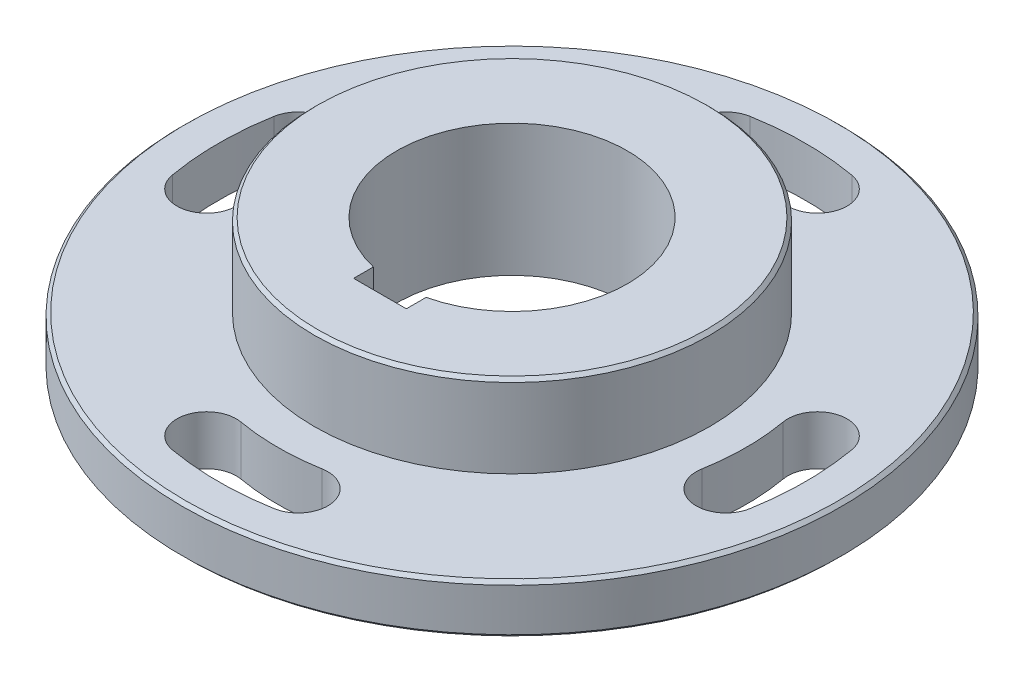
from build123d import *

# Parameters (mm, degrees)
CUT_EXTRUDE_1_DEPTH = 144.614066163
SKETCH_3_W          = 16
SKETCH_3_H          = 6
CUT_EXTRUDE_2_DEPTH = 147.969384567
CHAMFER_1_SIZE      = 1


with BuildPart() as part:
    # 草图1 → 旋转1 (revolve)
    with BuildSketch(Plane.XY, mode=Mode.PRIVATE) as revolve_1_sk:
        Polygon((35, 0), (100, 0), (100, 15), (60, 15), (60, 40), (35, 40), align=None)
    revolve(revolve_1_sk.sketch.rotate(Axis((0, 0, 0), (0, 1, 0)), 90), axis=Axis((0, 0, 0), (0, 1, 0)))

    # 草图2 → 切除-拉伸1 (cut, through all)
    with BuildSketch(Plane(origin=(0, 15, 0), x_dir=(1, 0, 0), z_dir=(0, 1, 0))):
        with BuildLine():
            ThreePointArc((15.454687812, 87.647890018), (0, 89), (-15.454687812, 87.647890018))
            ThreePointArc((-15.454687812, 87.647890018), (-22.75512399, 77.221786642), (-12.329020614, 69.921350464))
            ThreePointArc((-12.329020614, 69.921350464), (0, 71), (12.329020614, 69.921350464))
            ThreePointArc((12.329020614, 69.921350464), (22.75512399, 77.221786642), (15.454687812, 87.647890018))
        make_face()
        with BuildLine():
            ThreePointArc((69.921350464, -12.329020614), (77.221786642, -22.75512399), (87.647890018, -15.454687812))
            ThreePointArc((87.647890018, -15.454687812), (89, 0), (87.647890018, 15.454687812))
            ThreePointArc((87.647890018, 15.454687812), (77.221786642, 22.75512399), (69.921350464, 12.329020614))
            ThreePointArc((69.921350464, 12.329020614), (71, 0), (69.921350464, -12.329020614))
        make_face()
        with BuildLine():
            ThreePointArc((-12.329020614, -69.921350464), (-22.75512399, -77.221786642), (-15.454687812, -87.647890018))
            ThreePointArc((-15.454687812, -87.647890018), (0, -89), (15.454687812, -87.647890018))
            ThreePointArc((15.454687812, -87.647890018), (22.75512399, -77.221786642), (12.329020614, -69.921350464))
            ThreePointArc((12.329020614, -69.921350464), (0, -71), (-12.329020614, -69.921350464))
        make_face()
        with BuildLine():
            ThreePointArc((-69.921350464, 12.329020614), (-77.221786642, 22.75512399), (-87.647890018, 15.454687812))
            ThreePointArc((-87.647890018, 15.454687812), (-89, 0), (-87.647890018, -15.454687812))
            ThreePointArc((-87.647890018, -15.454687812), (-77.221786642, -22.75512399), (-69.921350464, -12.329020614))
            ThreePointArc((-69.921350464, -12.329020614), (-71, 0), (-69.921350464, 12.329020614))
        make_face()
    extrude(amount=-CUT_EXTRUDE_1_DEPTH, mode=Mode.SUBTRACT)

    # 草图3 → 切除-拉伸2 (cut, through all)
    with BuildSketch(Plane.XZ):
        with Locations((0, 37.073450075)):
            Rectangle(SKETCH_3_W, SKETCH_3_H)
    extrude(amount=-CUT_EXTRUDE_2_DEPTH, mode=Mode.SUBTRACT)

    # 倒角1
    chamfer_1_edges = [part.edges().sort_by_distance(p)[0] for p in [
        (0, 40, 60),
        (0, 15, 100),
        (0, 0, 100),
    ]]
    chamfer(chamfer_1_edges, length=CHAMFER_1_SIZE)


solid = part.part
